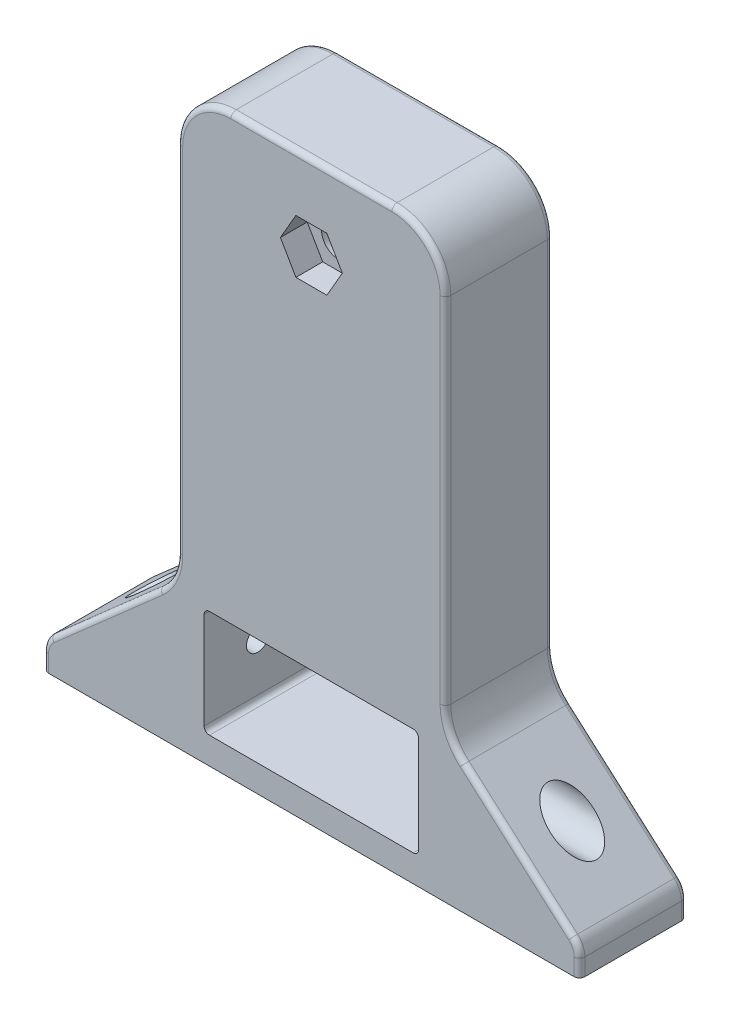
from build123d import *

# Parameters (mm, degrees)
BOSS_EXTRUDE1_DEPTH            = 20
CUT_EXTRUDE7_REACH             = 109.052
SKETCH8_R                      = 3.1
FILLET1_R                      = 1
CUT_EXTRUDE8_REACH             = 119.729
SKETCH9_R                      = 2.1
CUT_EXTRUDE8_DIRECTION_2_REACH = 119.729
CUT_EXTRUDE9_REACH             = 127.729
CUT_EXTRUDE9_START             = -8
SKETCH10_R                     = 4
CUT_EXTRUDE10_REACH            = 127.729
CUT_EXTRUDE10_START            = -8
SKETCH11_R                     = 4
CUT_EXTRUDE11_DEPTH            = 5
CUT_EXTRUDE12_DEPTH            = 5


with BuildPart() as part:
    # Sketch1 → Boss-Extrude1 (new body)
    with BuildSketch(Plane.XY):
        with BuildLine():
            Line((-50, -15), (50, -15))
            Line((50, -15), (50, -11.808264258))
            ThreePointArc((50, -11.808264258), (49.644862571, -10.16054558), (48.64251158, -8.80541019))
            Line((48.64251158, -8.80541019), (28.393721051, 9.013525475))
            ThreePointArc((28.393721051, 9.013525475), (25.887843573, 12.40136395), (25, 16.520660644))
            Line((25, 16.520660644), (25, 82.520660644))
            ThreePointArc((25, 82.520660644), (22.071067812, 89.591728456), (15, 92.520660644))
            Line((15, 92.520660644), (-15, 92.520660644))
            ThreePointArc((-15, 92.520660644), (-22.071067812, 89.591728456), (-25, 82.520660644))
            Line((-25, 82.520660644), (-25, 16.520660644))
            ThreePointArc((-25, 16.520660644), (-25.887843573, 12.40136395), (-28.393721051, 9.013525475))
            Line((-28.393721051, 9.013525475), (-48.64251158, -8.80541019))
            ThreePointArc((-48.64251158, -8.80541019), (-49.644862571, -10.16054558), (-50, -11.808264258))
            Line((-50, -11.808264258), (-50, -15))
        make_face()
        with BuildLine():
            Line((-19, 10), (19, 10))
            ThreePointArc((19, 10), (19.707106781, 9.707106781), (20, 9))
            Line((20, 9), (20, -9))
            ThreePointArc((20, -9), (19.707106781, -9.707106781), (19, -10))
            Line((19, -10), (-19, -10))
            ThreePointArc((-19, -10), (-19.707106781, -9.707106781), (-20, -9))
            Line((-20, -9), (-20, 9))
            ThreePointArc((-20, 9), (-19.707106781, 9.707106781), (-19, 10))
        make_face(mode=Mode.SUBTRACT)
    extrude(amount=BOSS_EXTRUDE1_DEPTH)

    # Sketch8 → Cut-Extrude7 (cut, up to next)
    with BuildSketch(Plane(origin=(0, 0, 0), x_dir=(-1, 0, 0), z_dir=(0, 0, -1)), mode=Mode.PRIVATE) as cut_extrude7_sk1:
        with Locations((0, 77)):
            Circle(SKETCH8_R)
    cut_extrude7_tool1 = extrude(cut_extrude7_sk1.sketch, amount=-CUT_EXTRUDE7_REACH, mode=Mode.PRIVATE) & part.part
    add(cut_extrude7_tool1.solids().sort_by_distance((0, 77, 0))[0], mode=Mode.SUBTRACT)

    # Fillet1
    fillet1_edges = [part.edges().sort_by_distance(p)[0] for p in [
        (50, -13.404132129, 20),
        (-49.644862571, -10.16054558, 0),
        (-38.518116315, 0.104057643, 0),
        (49.644862571, -10.16054558, 20),
        (-25.887843573, 12.40136395, 0),
        (-25, 49.520660644, 0),
        (-22.071067812, 89.591728456, 0),
        (0, 92.520660644, 0),
        (22.071067812, 89.591728456, 0),
        (25, 49.520660644, 0),
        (25.887843573, 12.40136395, 0),
        (38.518116315, 0.104057643, 20),
        (38.518116315, 0.104057643, 0),
        (49.644862571, -10.16054558, 0),
        (50, -13.404132129, 0),
        (-50, -13.404132129, 0),
        (25.887843573, 12.40136395, 20),
        (25, 49.520660644, 20),
        (22.071067812, 89.591728456, 20),
        (0, 92.520660644, 20),
        (-22.071067812, 89.591728456, 20),
        (-25, 49.520660644, 20),
        (-25.887843573, 12.40136395, 20),
        (-50, -13.404132129, 20),
        (-38.518116315, 0.104057643, 20),
        (-49.644862571, -10.16054558, 20),
    ]]
    fillet(fillet1_edges, radius=FILLET1_R)

    # Sketch9 → Cut-Extrude8 (cut, up to next)
    with BuildSketch(Plane.ZY.offset(-20), mode=Mode.PRIVATE) as cut_extrude8_sk1:
        with Locations(Location((10, 0, 0), (0, 0, 90))):
            Circle(SKETCH9_R)
    cut_extrude8_tool1 = extrude(cut_extrude8_sk1.sketch, amount=-CUT_EXTRUDE8_REACH, mode=Mode.PRIVATE) & part.part
    add(cut_extrude8_tool1.solids().sort_by_distance((20, 0, 10))[0], mode=Mode.SUBTRACT)

    # Sketch9 → Cut-Extrude8 direction 2 (cut, up to next)
    with BuildSketch(Plane.ZY.offset(-20), mode=Mode.PRIVATE) as cut_extrude8_direction_2_sk1:
        with Locations(Location((10, 0, 0), (0, 0, 90))):
            Circle(SKETCH9_R)
    cut_extrude8_direction_2_tool1 = extrude(cut_extrude8_direction_2_sk1.sketch, amount=CUT_EXTRUDE8_DIRECTION_2_REACH, mode=Mode.PRIVATE) & part.part
    add(cut_extrude8_direction_2_tool1.solids().sort_by_distance((20, 0, 10))[0], mode=Mode.SUBTRACT)

    # Cut-Extrude9: up to this plane
    cut_extrude9_end = Plane(origin=(48.64251158, -8.80541019, 20), z_dir=(-0.660627894892025, -0.750713516922755, 0))
    # Sketch10 → Cut-Extrude9 (cut, up to the surface)
    with BuildSketch(Plane.ZY.offset(-20).offset(CUT_EXTRUDE9_START), mode=Mode.PRIVATE) as cut_extrude9_sk1:
        with Locations(Location((10, 0, 0), (0, 0, 270))):
            Circle(SKETCH10_R)
    cut_extrude9_tool1 = split(extrude(cut_extrude9_sk1.sketch, amount=-CUT_EXTRUDE9_REACH, mode=Mode.PRIVATE), bisect_by=cut_extrude9_end, keep=Keep.BOTH, mode=Mode.PRIVATE)
    add(cut_extrude9_tool1.solids().sort_by_distance((28, 0, 10))[0], mode=Mode.SUBTRACT)

    # Cut-Extrude10: up to this plane
    cut_extrude10_end = Plane(origin=(-48.64251158, -8.80541019, 20), z_dir=(0.6606278948920247, -0.7507135169227553, 0))
    # Sketch11 → Cut-Extrude10 (cut, up to the surface)
    with BuildSketch(Plane(origin=(-20, 0, 0), x_dir=(0, 0, -1), z_dir=(1, 0, 0)).offset(CUT_EXTRUDE10_START), mode=Mode.PRIVATE) as cut_extrude10_sk1:
        with Locations(Location((-10, 0, 0), (0, 0, 270))):
            Circle(SKETCH11_R)
    cut_extrude10_tool1 = split(extrude(cut_extrude10_sk1.sketch, amount=-CUT_EXTRUDE10_REACH, mode=Mode.PRIVATE), bisect_by=cut_extrude10_end, keep=Keep.BOTH, mode=Mode.PRIVATE)
    add(cut_extrude10_tool1.solids().sort_by_distance((-28, 0, 10))[0], mode=Mode.SUBTRACT)

    # Sketch12 → Cut-Extrude11 (cut)
    with BuildSketch(Plane(origin=(0, 0, 0), x_dir=(-1, 0, 0), z_dir=(0, 0, -1))):
        Polygon((5.773502692, 77), (2.886751346, 82), (-2.886751346, 82), (-5.773502692, 77), (-2.886751346, 72), (2.886751346, 72), align=None)
    extrude(amount=-CUT_EXTRUDE11_DEPTH, mode=Mode.SUBTRACT)

    # Sketch13 → Cut-Extrude12 (cut)
    with BuildSketch(Plane.XY.offset(20)):
        Polygon((5.773502692, 77), (2.886751346, 82), (-2.886751346, 82), (-5.773502692, 77), (-2.886751346, 72), (2.886751346, 72), align=None)
    extrude(amount=-CUT_EXTRUDE12_DEPTH, mode=Mode.SUBTRACT)


solid = part.part
